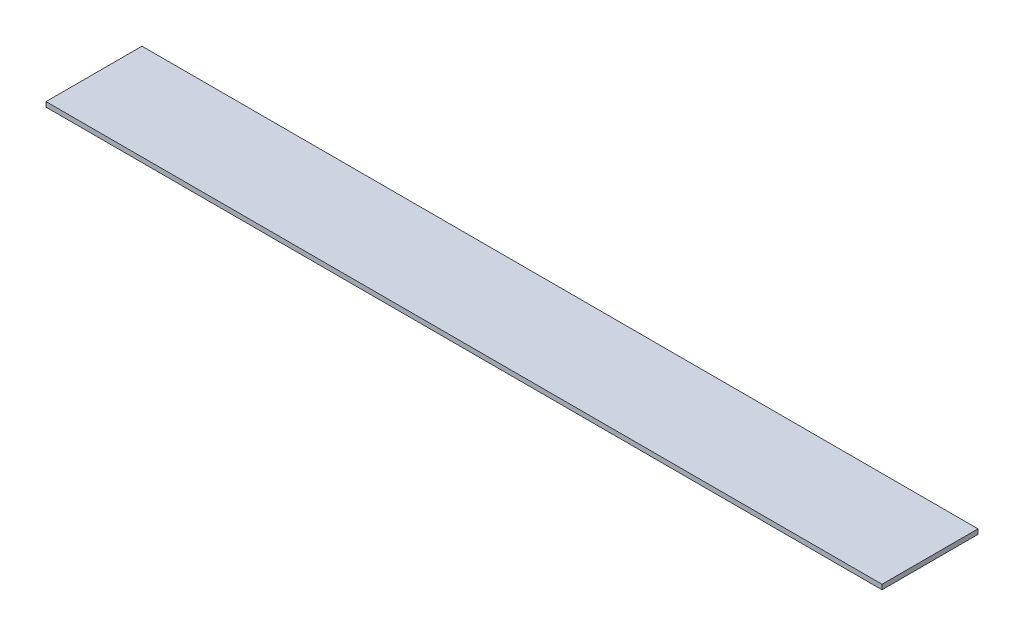
from build123d import *

# Parameters (mm, degrees)
SKETCH1_W           = 50
SKETCH1_H           = 2.51714
BOSS_EXTRUDE1_DEPTH = 435.49512


with BuildPart() as part:
    # Sketch1 → Boss-Extrude1 (new body)
    with BuildSketch(Plane(origin=(0, 0, 0), x_dir=(0, 0, -1), z_dir=(1, 0, 0))):
        Rectangle(SKETCH1_W, SKETCH1_H)
    extrude(amount=BOSS_EXTRUDE1_DEPTH)


solid = part.part
